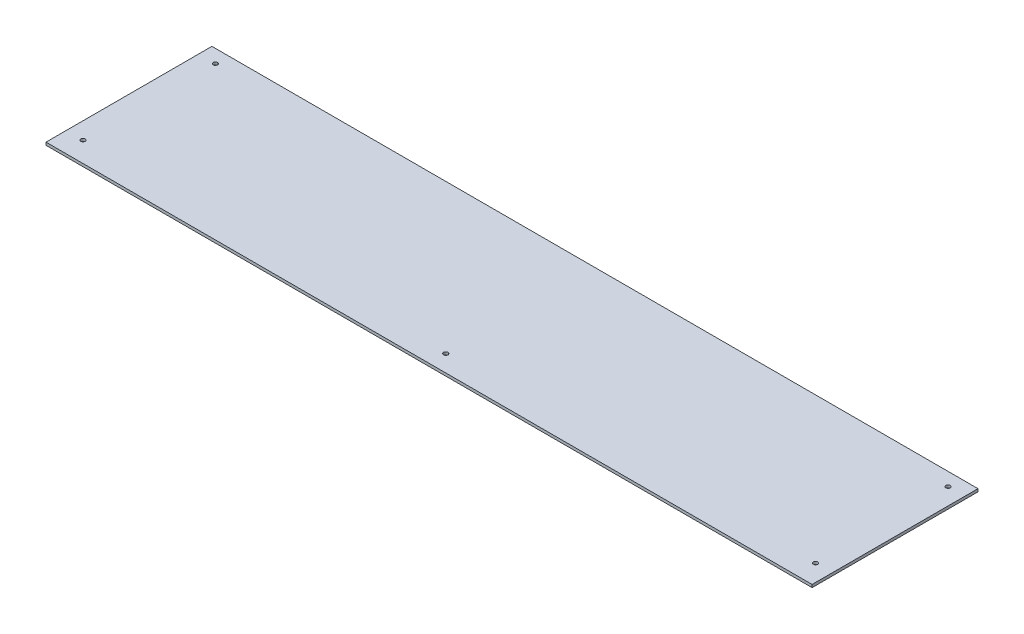
from build123d import *

# Parameters (mm, degrees)
CROQUIS1_W              = 550.5
CROQUIS1_H              = 120
CROQUIS1_R              = 1.55
SALIENTE_EXTRUIR1_DEPTH = 2
CROQUIS2_W              = 550.5
CROQUIS2_H              = 120
CROQUIS2_W_2            = 549.5
CROQUIS2_H_2            = 119
CORTAR_EXTRUIR1_DEPTH   = 2
CROQUIS3_R              = 1.6
CORTAR_EXTRUIR2_DEPTH   = 2


with BuildPart() as part:
    # Croquis1 → Saliente-Extruir1 (new body)
    with BuildSketch(Plane(origin=(0, 0, 0), x_dir=(1, 0, 0), z_dir=(0, 1, 0))):
        with Locations((275.25, 60)):
            Rectangle(CROQUIS1_W, CROQUIS1_H)
        with Locations(Location((12.5, 15, 0), (0, 0, 270))):
            Circle(CROQUIS1_R, mode=Mode.SUBTRACT)
        with Locations(Location((12.5, 110, 0), (0, 0, 270))):
            Circle(CROQUIS1_R, mode=Mode.SUBTRACT)
        with Locations(Location((538, 15, 0), (0, 0, 90))):
            Circle(CROQUIS1_R, mode=Mode.SUBTRACT)
        with Locations(Location((538, 110, 0), (0, 0, 90))):
            Circle(CROQUIS1_R, mode=Mode.SUBTRACT)
    extrude(amount=SALIENTE_EXTRUIR1_DEPTH)

    # Croquis2 → Cortar-Extruir1 (cut)
    with BuildSketch(Plane.XZ):
        with Locations((275.25, -60)):
            Rectangle(CROQUIS2_W, CROQUIS2_H)
        with Locations((275.25, -60)):
            Rectangle(CROQUIS2_W_2, CROQUIS2_H_2, mode=Mode.SUBTRACT)
    extrude(amount=-CORTAR_EXTRUIR1_DEPTH, mode=Mode.SUBTRACT)

    # Croquis3 → Cortar-Extruir2 (cut)
    with BuildSketch(Plane.XZ):
        with Locations(Location((275.25, -12.5, 0), (0, 0, 270))):
            Circle(CROQUIS3_R)
    extrude(amount=-CORTAR_EXTRUIR2_DEPTH, mode=Mode.SUBTRACT)


solid = part.part
